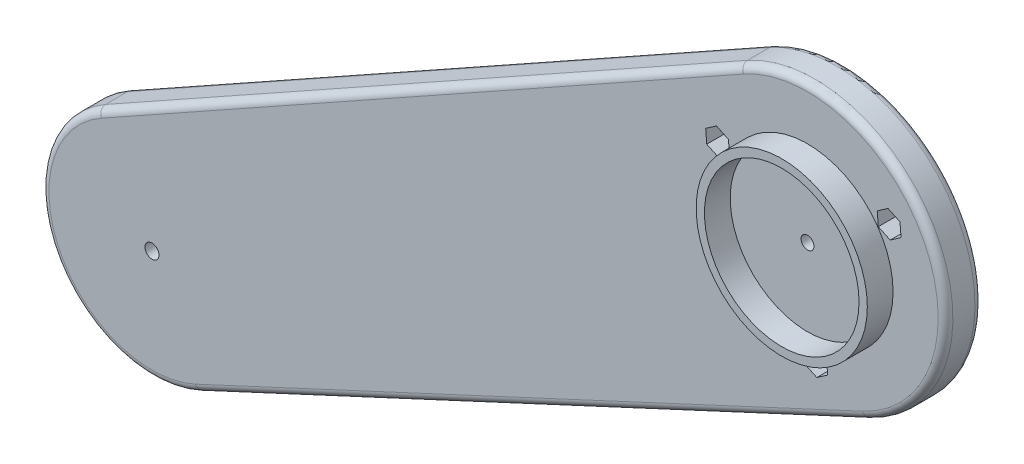
from build123d import *

# Parameters (mm, degrees)
BOSS_EXTRUDE1_DEPTH = 10
FILLET1_R           = 2
SKETCH3_R           = 1.9
CUT_EXTRUDE3_DEPTH  = 240
CUT_EXTRUDE4_DEPTH  = 5
SKETCH6_R           = 1.75
CUT_EXTRUDE8_DEPTH  = 10
SKETCH7_R           = 23.25
SKETCH7_R_2         = 21
BOSS_EXTRUDE2_DEPTH = 7
CUT_EXTRUDE9_DEPTH  = 5
SKETCH9_R           = 1.75
CUT_EXTRUDE10_DEPTH = 10


with BuildPart() as part:
    # Sketch1 → Boss-Extrude1 (new body)
    with BuildSketch(Plane.XY):
        with BuildLine():
            Line((-192.723621419, -64.866060055), (-18.311266157, 32.725334708))
            ThreePointArc((-18.311266157, 32.725334708), (33.388989093, 17.071186467), (15.807091975, -34.005673693))
            Line((15.807091975, -34.005673693), (-165.428934914, -118.250866776))
            ThreePointArc((-165.428934914, -118.250866776), (-204.785799768, -104.703276995), (-192.723621419, -64.866060055))
        make_face()
    extrude(amount=BOSS_EXTRUDE1_DEPTH)

    # Fillet1
    fillet1_edges = [part.edges().sort_by_distance(p)[0] for p in [
        (33.388989093, 17.071186467, 10),
        (-105.517443788, -16.070362674, 10),
        (-204.785799768, -104.703276995, 10),
        (-105.517443788, -16.070362674, 0),
        (33.388989093, 17.071186467, 0),
        (-74.81092147, -76.128270234, 0),
        (-204.785799768, -104.703276995, 0),
        (-74.81092147, -76.128270234, 10),
    ]]
    fillet(fillet1_edges, radius=FILLET1_R)

    # Sketch3 → Cut-Extrude3 (cut)
    with BuildSketch(Plane.XY.offset(10)):
        with Locations((-178.074608494, -91.046327822)):
            Circle(SKETCH3_R)
    extrude(amount=-CUT_EXTRUDE3_DEPTH, mode=Mode.SUBTRACT)

    # Sketch4 → Cut-Extrude4 (cut)
    with BuildSketch(Plane.XY.offset(10)):
        Polygon((1.949051074, -23.338757463), (-0.99159812, -25.380566053), (-0.693664608, -28.948147254), (2.544918098, -30.473919864), (5.485567292, -28.432111274), (5.18763378, -24.864530073), align=None)
        Polygon((19.237431318, 13.357306475), (22.476014024, 11.831533865), (25.416663218, 13.873342455), (25.118729706, 17.440923655), (21.880147001, 18.966696266), (18.939497807, 16.924887676), align=None)
        Polygon((-21.186482393, 9.981450988), (-21.484415905, 13.549032188), (-24.72299861, 15.074804799), (-27.663647804, 13.032996209), (-27.365714292, 9.465415008), (-24.127131587, 7.939642398), align=None)
    extrude(amount=-CUT_EXTRUDE4_DEPTH, mode=Mode.SUBTRACT)

    # Sketch6 → Cut-Extrude8 (cut)
    with BuildSketch(Plane.XY.offset(10)):
        with Locations((2.246984586, -26.906338663)):
            Circle(SKETCH6_R)
        with Locations((-24.425065098, 11.507223598)):
            Circle(SKETCH6_R)
        with Locations((22.178080512, 15.399115065)):
            Circle(SKETCH6_R)
    extrude(amount=-CUT_EXTRUDE8_DEPTH, mode=Mode.SUBTRACT)

    # Sketch7 → Boss-Extrude2 (add)
    with BuildSketch(Plane.XY.offset(10)):
        Circle(SKETCH7_R)
        Circle(SKETCH7_R_2, mode=Mode.SUBTRACT)
    extrude(amount=BOSS_EXTRUDE2_DEPTH)

    # Sketch8 → Cut-Extrude9 (cut)
    with BuildSketch(Plane(origin=(0, 0, 0), x_dir=(-1, 0, 0), z_dir=(0, 0, -1))):
        Polygon((181.262166534, -92.676012988), (181.079736268, -89.100664166), (177.892178228, -87.470979), (174.887050454, -89.416642655), (175.06948072, -92.991991477), (178.25703876, -94.621676643), align=None)
    extrude(amount=-CUT_EXTRUDE9_DEPTH, mode=Mode.SUBTRACT)

    # Sketch9 → Cut-Extrude10 (cut)
    with BuildSketch(Plane.XY.offset(10)):
        Circle(SKETCH9_R)
    extrude(amount=-CUT_EXTRUDE10_DEPTH, mode=Mode.SUBTRACT)


solid = part.part
